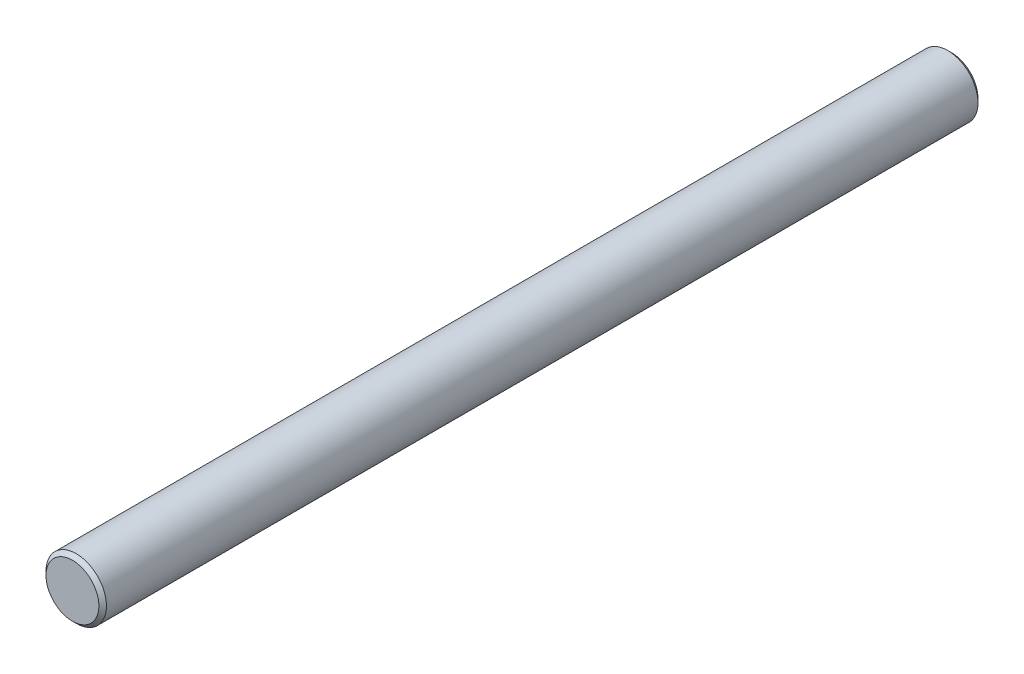
from build123d import *
from OCP.BRepFilletAPI import BRepFilletAPI_MakeChamfer

# Parameters (mm, degrees)
CHAMFER1_SIZE      = 0.5
CHAMFER2_SIZE      = 0.3
CHAMFER2_SIZE2     = 0.173205081
SKETCH2_W          = 23.197150539
SKETCH2_H          = 11.802059046
CUT_EXTRUDE1_DEPTH = 50
CHAMFER3_SIZE      = 0.5


with BuildPart() as part:
    # Sketch1 → Revolve1 (revolve)
    with BuildSketch(Plane(origin=(0, 0, 0), x_dir=(1, 0, 0), z_dir=(0, 1, 0)), mode=Mode.PRIVATE) as revolve1_sk:
        Polygon((-1, 0), (-4, 0), (-4, -121), (-1, -121), (-1, -119), (0, -119), (0, -2), (-1, -2), align=None)
    revolve(revolve1_sk.sketch.rotate(Axis((0, 0, 119), (0, 0, -1)), 180), axis=Axis((0, 0, 119), (0, 0, -1)))

    # Chamfer1
    chamfer1_edges = [part.edges().sort_by_distance(p)[0] for p in [
        (-4, 0, 121),
        (-4, 0, 0),
    ]]
    chamfer(chamfer1_edges, length=CHAMFER1_SIZE)

    # Chamfer2: one chamfer whose edges measure the first distance from different faces: ONE call of the kernel's chamfer builder (chamfer() names one face for all edges)
    chamfer2_edges_1 = [part.edges().sort_by_distance(p)[0] for p in [
        (-1, 0, 2),
    ]]
    chamfer2_side_1 = [part.faces().sort_by_distance(p)[0] for p in [
        (0, 0, 2),
    ]]
    chamfer2_edges_2 = [part.edges().sort_by_distance(p)[0] for p in [
        (-1, 0, 119),
    ]]
    chamfer2_side_2 = [part.faces().sort_by_distance(p)[0] for p in [
        (-1, 0, 120),
    ]]
    chamfer2_edges_3 = [part.edges().sort_by_distance(p)[0] for p in [
        (-1, 0, 121),
    ]]
    chamfer2_side_3 = [part.faces().sort_by_distance(p)[0] for p in [
        (-3.401005051, 0, 121),
    ]]
    chamfer2_edges_4 = [part.edges().sort_by_distance(p)[0] for p in [
        (-1, 0, 0),
    ]]
    chamfer2_side_4 = [part.faces().sort_by_distance(p)[0] for p in [
        (-1, 0, 1),
    ]]
    chamfer2 = BRepFilletAPI_MakeChamfer(part.part.solid().wrapped)
    for e in chamfer2_edges_1:
        chamfer2.Add(CHAMFER2_SIZE, CHAMFER2_SIZE2, e.wrapped, chamfer2_side_1[0].wrapped)  # the first distance lies on this face
    for e in chamfer2_edges_2:
        chamfer2.Add(CHAMFER2_SIZE, CHAMFER2_SIZE2, e.wrapped, chamfer2_side_2[0].wrapped)  # the first distance lies on this face
    for e in chamfer2_edges_3:
        chamfer2.Add(CHAMFER2_SIZE, CHAMFER2_SIZE2, e.wrapped, chamfer2_side_3[0].wrapped)  # the first distance lies on this face
    for e in chamfer2_edges_4:
        chamfer2.Add(CHAMFER2_SIZE, CHAMFER2_SIZE2, e.wrapped, chamfer2_side_4[0].wrapped)  # the first distance lies on this face
    add(Compound.cast(chamfer2.Shape()), mode=Mode.REPLACE)

    # Sketch2 → Cut-Extrude1 (cut)
    with BuildSketch(Plane(origin=(0, 28.2, 0), x_dir=(1, 0, 0), z_dir=(0, 1, 0))):
        with Locations((2.541571207, -122.251029523)):
            Rectangle(SKETCH2_W, SKETCH2_H)
    extrude(amount=-CUT_EXTRUDE1_DEPTH, mode=Mode.SUBTRACT)

    # Chamfer3
    chamfer3_edges = [part.edges().sort_by_distance(p)[0] for p in [
        (-4, 0, 116.35),
    ]]
    chamfer(chamfer3_edges, length=CHAMFER3_SIZE)


solid = part.part
